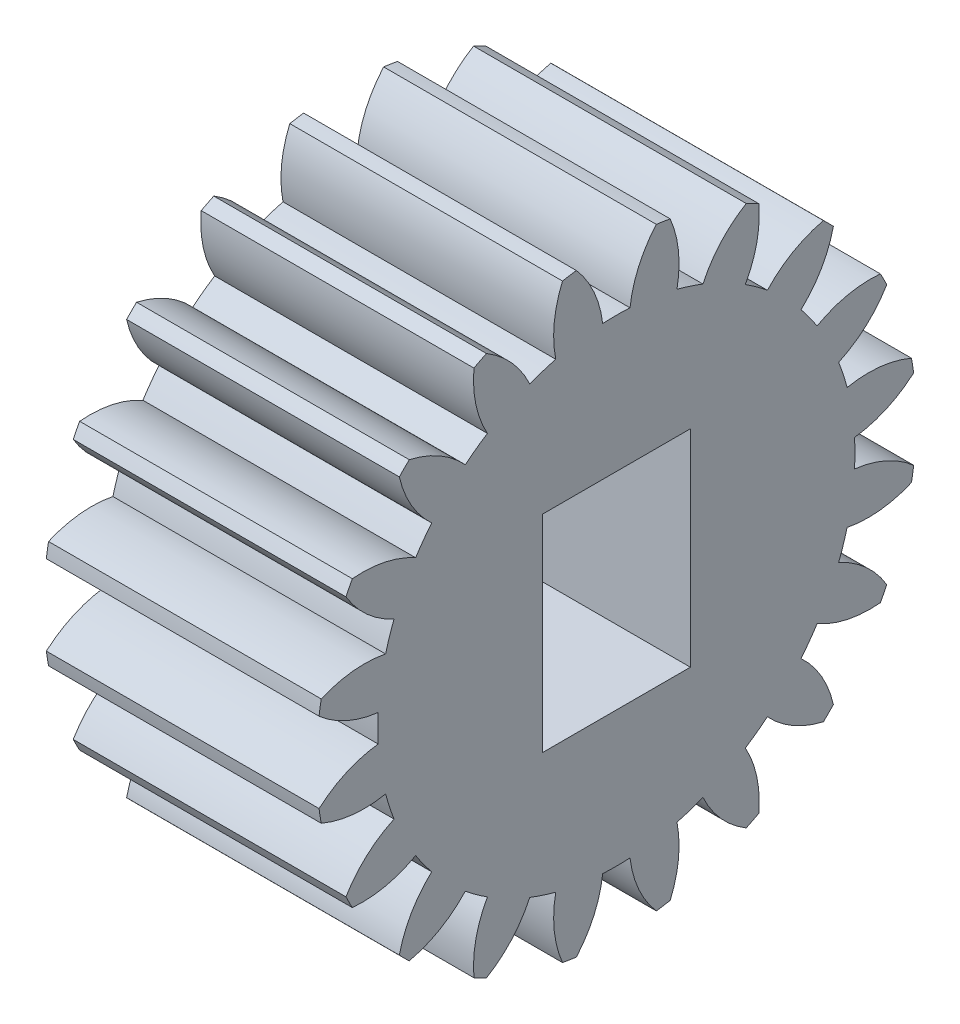
from build123d import *

# Parameters (mm, degrees)
BASPROSKE_W             = 7
BASPROSKE_H             = 7.7
TOOTHCUT_DEPTH          = 13.945269406
TEETHCUTS_COUNT         = 20
TEETHCUTS_ANGLE         = 342
BORSKE_R                = 0.5
BORE_DEPTH              = 50.0000508
CUT_EXTRUDE1_DEPTH      = 13.86365753
CUT_EXTRUDE1_DEPTH_BACK = 13.86365753
SKETCH1_W               = 3.8
SKETCH1_H               = 5.3


with BuildPart() as part:
    # BasProSke → Base-Revolve (revolve)
    with BuildSketch(Plane(origin=(0, 0, 0), x_dir=(1, 0, 0), z_dir=(0, 1, 0)), mode=Mode.PRIVATE) as base_revolve_sk:
        with Locations((3.5, 3.85)):
            Rectangle(BASPROSKE_W, BASPROSKE_H)
    revolve(base_revolve_sk.sketch.rotate(Axis((-10, 0, 0), (1, 0, 0)), 180), axis=Axis((-10, 0, 0), (1, 0, 0)))

    # TooCutSke → ToothCut (cut, through all)
    with BuildSketch(Plane(origin=(0, 0, 0), x_dir=(0, 0, -1), z_dir=(1, 0, 0))):
        with BuildLine():
            ThreePointArc((0.350524468, 6.11396014), (0, 6.124), (-0.350524468, 6.11396014))
            ThreePointArc((-0.350524468, 6.11396014), (-0.579534642, 6.937844235), (-1.04652851, 7.654187301))
            ThreePointArc((-1.04652851, 7.654187301), (0, 7.7254), (1.04652851, 7.654187301))
            ThreePointArc((1.04652851, 7.654187301), (0.579534642, 6.937844235), (0.350524468, 6.11396014))
        make_face()
    toothcut = extrude(amount=TOOTHCUT_DEPTH, mode=Mode.SUBTRACT)

    # TeethCuts: ToothCut ×20 about axis
    teethcuts_axis = Axis((-10, 0, 0), (1, 0, 0))
    for i in range(1, TEETHCUTS_COUNT):
        add(toothcut.rotate(teethcuts_axis, i * TEETHCUTS_ANGLE / (TEETHCUTS_COUNT - 1)), mode=Mode.SUBTRACT)

    # BorSke → Bore (cut, symmetric)
    with BuildSketch(Plane(origin=(0, 0, 0), x_dir=(0, 0, -1), z_dir=(1, 0, 0))):
        with Locations(Location((0, 0, 0), (0, 0, 180))):
            Circle(BORSKE_R)
    extrude(amount=BORE_DEPTH, both=True, mode=Mode.SUBTRACT)

    # Sketch1 → Cut-Extrude1 (cut, two sides: drawn at the far end of the back side and taken through both)
    with BuildSketch(Plane(origin=(7, 0, 0), x_dir=(0, 0, -1), z_dir=(1, 0, 0)).offset(-CUT_EXTRUDE1_DEPTH_BACK)):
        Rectangle(SKETCH1_W, SKETCH1_H)
    extrude(amount=CUT_EXTRUDE1_DEPTH + CUT_EXTRUDE1_DEPTH_BACK, mode=Mode.SUBTRACT)


solid = part.part
